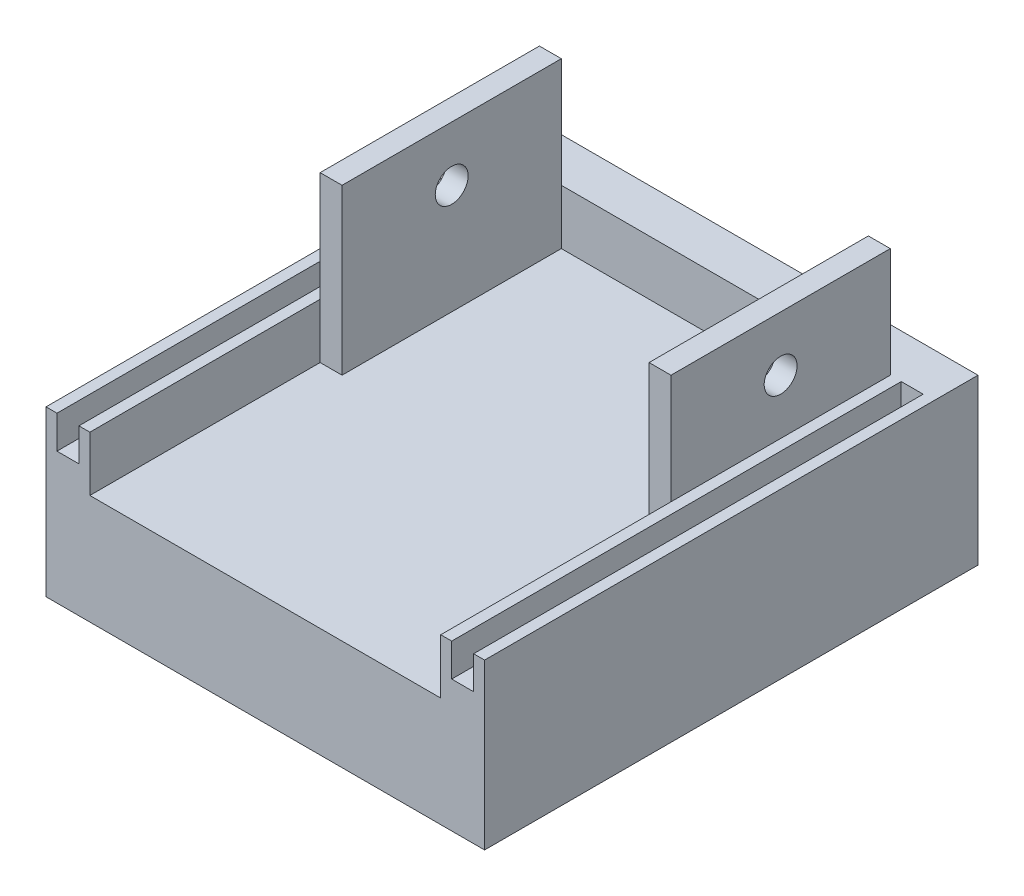
from build123d import *

# Parameters (mm, degrees)
SKETCH1_W               = 40
SKETCH1_H               = 45
BOSS_EXTRUDE1_DEPTH     = 10
SKETCH2_W               = 40
SKETCH2_H               = 4
BOSS_EXTRUDE2_DEPTH     = 5
SKETCH3_W               = 4
SKETCH3_H               = 41
BOSS_EXTRUDE3_DEPTH     = 5
SKETCH4_W               = 2
SKETCH4_H               = 41
CUT_EXTRUDE1_DEPTH      = 3
SKETCH5_W               = 2
SKETCH5_H               = 20
BOSS_EXTRUDE4_DEPTH     = 15
CUT_EXTRUDE2_DEPTH      = 50.267129001
CUT_EXTRUDE2_DEPTH_BACK = 50.267129001
SKETCH8_R               = 1.5


with BuildPart() as part:
    # Sketch1 → Boss-Extrude1 (new body)
    with BuildSketch(Plane(origin=(0, 0, 0), x_dir=(1, 0, 0), z_dir=(0, 1, 0))):
        Rectangle(SKETCH1_W, SKETCH1_H)
    extrude(amount=BOSS_EXTRUDE1_DEPTH)

    # Sketch2 → Boss-Extrude2 (add)
    with BuildSketch(Plane(origin=(0, 10, 0), x_dir=(1, 0, 0), z_dir=(0, 1, 0))):
        with Locations((0, 20.5)):
            Rectangle(SKETCH2_W, SKETCH2_H)
    extrude(amount=BOSS_EXTRUDE2_DEPTH)

    # Sketch3 → Boss-Extrude3 (add)
    with BuildSketch(Plane(origin=(0, 10, 0), x_dir=(1, 0, 0), z_dir=(0, 1, 0))):
        with Locations((-18, -2)):
            Rectangle(SKETCH3_W, SKETCH3_H)
    boss_extrude3 = extrude(amount=BOSS_EXTRUDE3_DEPTH)

    # Sketch4 → Cut-Extrude1 (cut)
    with BuildSketch(Plane(origin=(0, 15, 0), x_dir=(1, 0, 0), z_dir=(0, 1, 0))):
        with Locations((-18, -2)):
            Rectangle(SKETCH4_W, SKETCH4_H)
    cut_extrude1 = extrude(amount=-CUT_EXTRUDE1_DEPTH, mode=Mode.SUBTRACT)

    # Mirror1: Boss-Extrude3, Cut-Extrude1 across plane
    add(boss_extrude3.mirror(Plane(origin=(0, 0, 0), x_dir=(0, 0, 1), z_dir=(1, 0, 0))))
    add(cut_extrude1.mirror(Plane(origin=(0, 0, 0), x_dir=(0, 0, 1), z_dir=(1, 0, 0))), mode=Mode.SUBTRACT)

    # Sketch5 → Boss-Extrude4 (add)
    with BuildSketch(Plane(origin=(0, 10, 0), x_dir=(1, 0, 0), z_dir=(0, 1, 0))):
        with Locations((-15, 8.5)):
            Rectangle(SKETCH5_W, SKETCH5_H)
    boss_extrude4 = extrude(amount=BOSS_EXTRUDE4_DEPTH)

    # Mirror2: Boss-Extrude4 across plane
    add(boss_extrude4.mirror(Plane(origin=(0, 0, 0), x_dir=(0, 0, 1), z_dir=(1, 0, 0))))

    # Sketch8 → Cut-Extrude2 (cut, two sides: drawn at the far end of the back side and taken through both)
    with BuildSketch(Plane(origin=(16, 0, 0), x_dir=(0, 0, -1), z_dir=(1, 0, 0)).offset(-CUT_EXTRUDE2_DEPTH_BACK)):
        with Locations((8.5, 20)):
            Circle(SKETCH8_R)
    extrude(amount=CUT_EXTRUDE2_DEPTH + CUT_EXTRUDE2_DEPTH_BACK, mode=Mode.SUBTRACT)


solid = part.part
